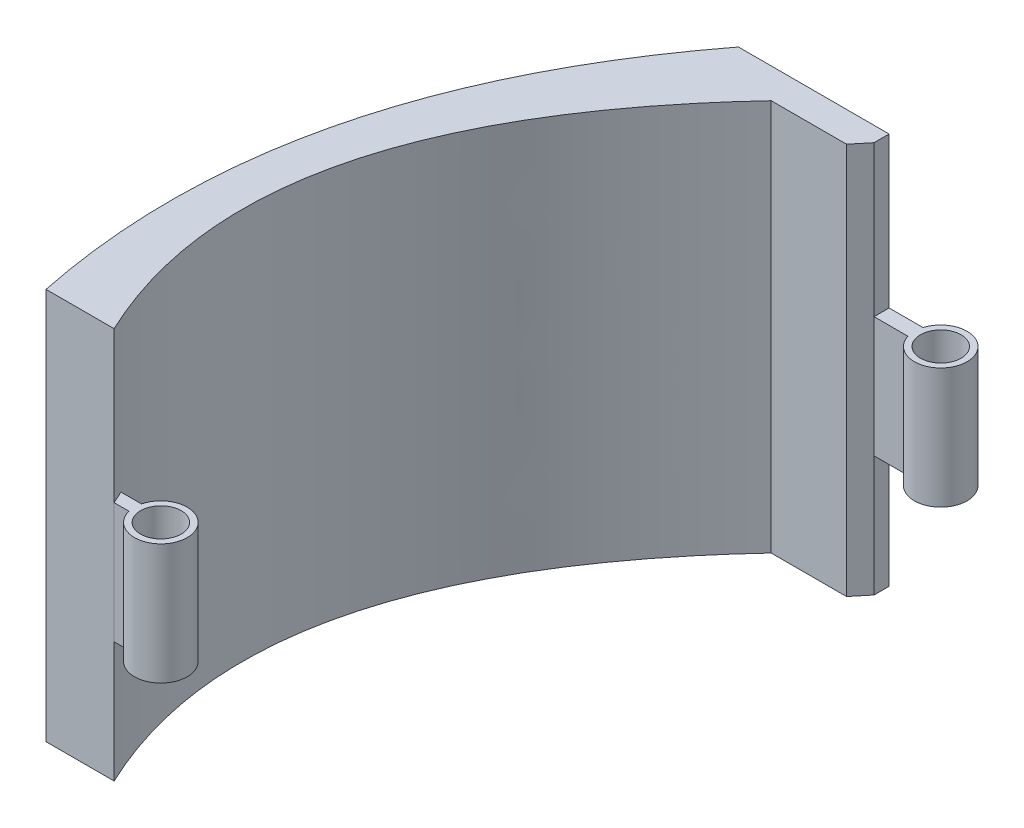
from build123d import *

# Parameters (mm, degrees)
BOSS_EXTRUDE1_DEPTH = 26
BOSS_EXTRUDE2_START = -10
BOSS_EXTRUDE2_DEPTH = 8
SKETCH3_R           = 1.35
CUT_EXTRUDE1_DEPTH  = 47.046014969
BOSS_EXTRUDE3_START = -10
BOSS_EXTRUDE3_DEPTH = 8
SKETCH5_R           = 1.35
CUT_EXTRUDE2_DEPTH  = 47.046014969


with BuildPart() as part:
    # Sketch1 → Boss-Extrude1 (new body)
    with BuildSketch(Plane(origin=(0, 0, 0), x_dir=(1, 0, 0), z_dir=(0, 1, 0))):
        with BuildLine():
            Line((4.528508304, 36.907186285), (14.528508304, 36.907186285))
            Line((14.528508304, 36.907186285), (14.528508304, 35.907186285))
            Line((14.528508304, 35.907186285), (13.702044813, 34.907186285))
            Line((13.702044813, 34.907186285), (8.702044813, 34.907186285))
            add(Edge.make_bspline(
                [(8.702044813, 34.907186285), (-8.047895334, 17.004513085), (0, 0)],
                knots=[0, 0, 0, 1, 1, 1], degree=2))
            Line((0, 0), (-4.519121247, 0))
            add(Edge.make_bspline(
                [(-4.519121247, 0), (-8.600172805, 19.797575634), (4.528508304, 36.907186285)],
                knots=[0, 0, 0, 1, 1, 1], degree=2))
        make_face()
    extrude(amount=BOSS_EXTRUDE1_DEPTH)

    # Sketch2 → Boss-Extrude2 (add)
    with BuildSketch(Plane(origin=(0, 26, 0), x_dir=(1, 0, 0), z_dir=(0, 1, 0)).offset(BOSS_EXTRUDE2_START)):
        with BuildLine():
            Line((14.528508304, 36.907186285), (16.778508304, 36.907186285))
            ThreePointArc((16.778508304, 36.907186285), (20.205559287, 36.407186285), (16.778508304, 35.907186285))
            Line((16.778508304, 35.907186285), (14.528508304, 35.907186285))
            Line((14.528508304, 35.907186285), (14.528508304, 36.907186285))
        make_face()
    extrude(amount=-BOSS_EXTRUDE2_DEPTH)

    # Sketch3 → Cut-Extrude1 (cut, through all)
    with BuildSketch(Plane(origin=(0, 16, 0), x_dir=(1, 0, 0), z_dir=(0, 1, 0))):
        with Locations(Location((18.455559287, 36.407186285, 0), (0, 0, 270))):
            Circle(SKETCH3_R)
    extrude(amount=-CUT_EXTRUDE1_DEPTH, mode=Mode.SUBTRACT)


with BuildPart() as body_2:
    # Sketch4 → Boss-Extrude3 (new body)
    with BuildSketch(Plane(origin=(0, 26, 0), x_dir=(1, 0, 0), z_dir=(0, 1, 0)).offset(BOSS_EXTRUDE3_START)):
        with BuildLine():
            Line((-0.380093585, 0.835205754), (0.986955671, 0.835205754))
            ThreePointArc((0.986955671, 0.835205754), (4.436399061, 0.417602877), (0.986955671, 0))
            Line((0.986955671, 0), (0, 0))
            Line((0, 0), (-0.380093585, 0.835205754))
        make_face()
    extrude(amount=-BOSS_EXTRUDE3_DEPTH)

    # Sketch5 → Cut-Extrude2 (cut, through all)
    with BuildSketch(Plane(origin=(0, 16, 0), x_dir=(1, 0, 0), z_dir=(0, 1, 0))):
        with Locations(Location((2.686399061, 0.417602877, 0), (0, 0, 270))):
            Circle(SKETCH5_R)
    extrude(amount=-CUT_EXTRUDE2_DEPTH, mode=Mode.SUBTRACT)


solid = Compound([part.part, body_2.part])
